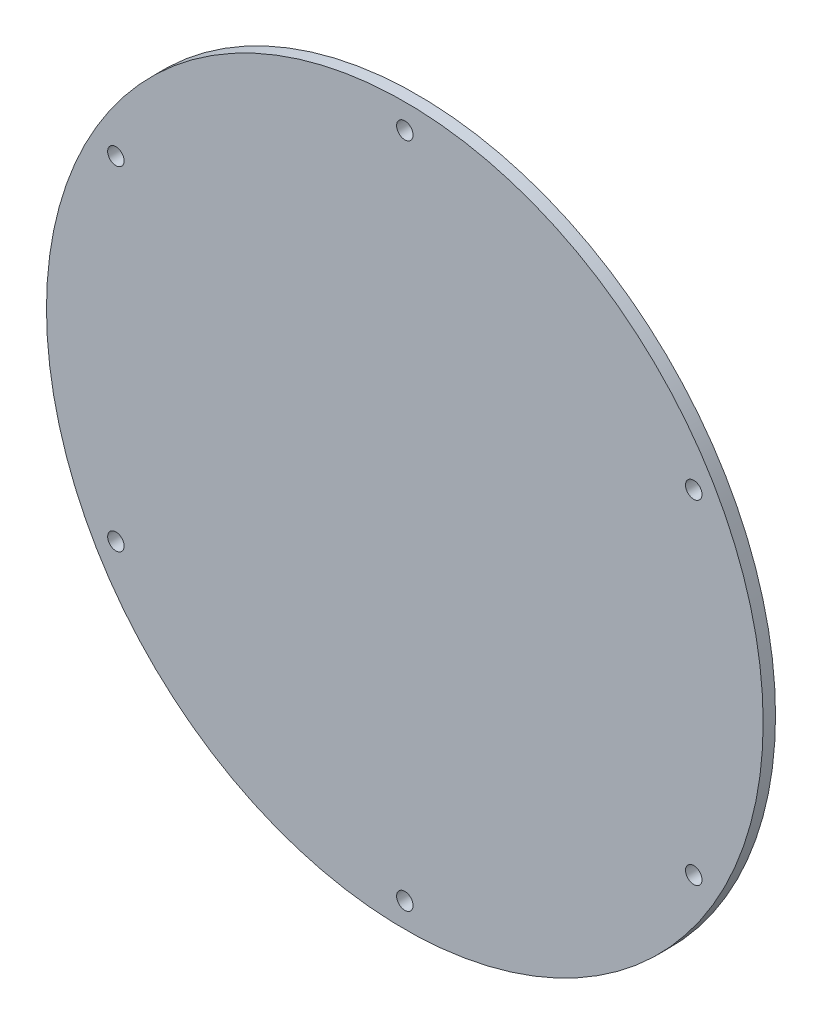
from build123d import *

# Parameters (mm, degrees)
SKETCH1_R           = 174
SKETCH1_R_2         = 4
BOSS_EXTRUDE1_DEPTH = 6


with BuildPart() as part:
    # Sketch1 → Boss-Extrude1 (new body)
    with BuildSketch(Plane.XY):
        Circle(SKETCH1_R)
        with Locations((0, 162)):
            Circle(SKETCH1_R_2, mode=Mode.SUBTRACT)
        with Locations((140.296115413, 81)):
            Circle(SKETCH1_R_2, mode=Mode.SUBTRACT)
        with Locations((140.296115413, -81)):
            Circle(SKETCH1_R_2, mode=Mode.SUBTRACT)
        with Locations((0, -162)):
            Circle(SKETCH1_R_2, mode=Mode.SUBTRACT)
        with Locations((-140.296115413, -81)):
            Circle(SKETCH1_R_2, mode=Mode.SUBTRACT)
        with Locations((-140.296115413, 81)):
            Circle(SKETCH1_R_2, mode=Mode.SUBTRACT)
    extrude(amount=BOSS_EXTRUDE1_DEPTH)


solid = part.part
